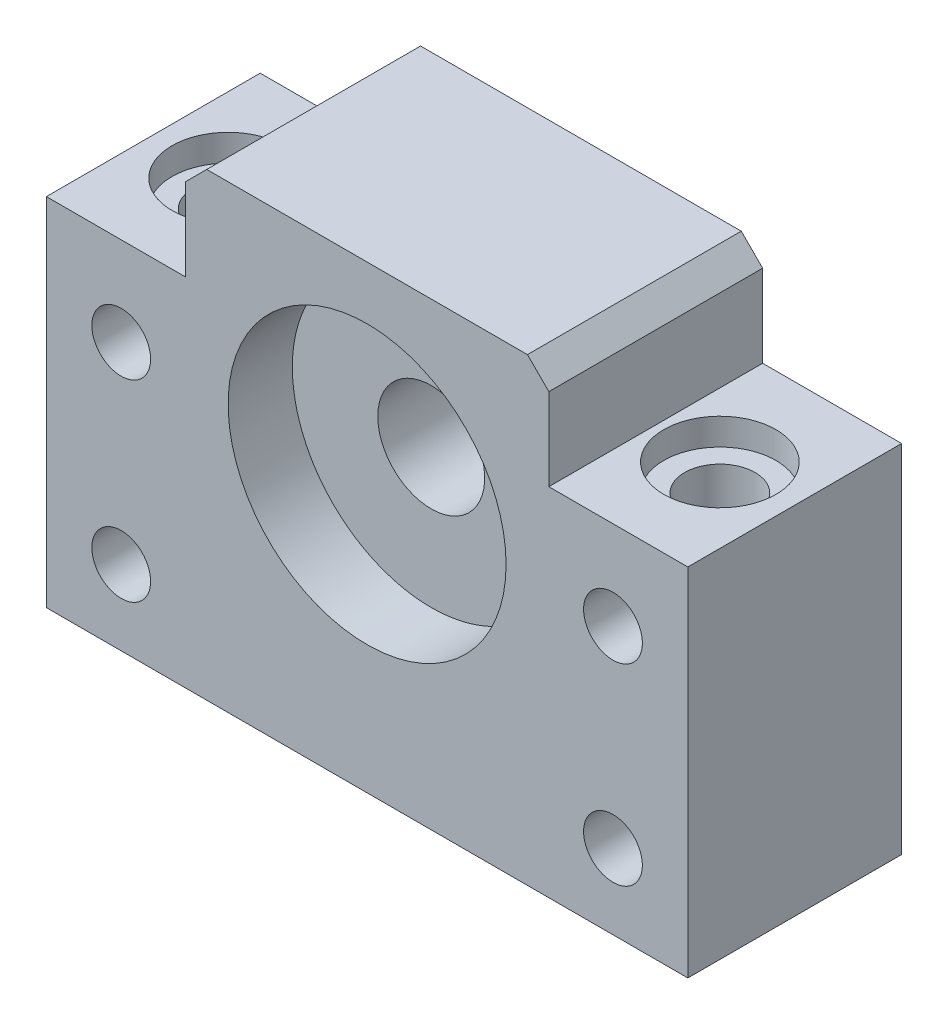
from build123d import *

# Parameters (mm, degrees)
SKIZZE1_R                       = 13
SKIZZE1_R_2                     = 2.75
AUFSATZ_LINEAR_AUSTRAGEN1_DEPTH = 10
AUFSATZ_LINEAR_START            = -6
SKIZZE2_R                       = 13
SKIZZE2_R_2                     = 5
AUFSATZ_LINEAR_AUSTRAGEN2_DEPTH = 8
SKIZZE3_R                       = 3.3
SCHNITT_LINEAR_AUSTRAGEN1_DEPTH = 60
SKIZZE4_R                       = 5.25
SCHNITT_LINEAR_AUSTRAGEN2_DEPTH = 2.5


with BuildPart() as part:
    # Skizze1 → Aufsatz-Linear austragen1 (new, symmetric)
    with BuildSketch(Plane.XY):
        Polygon((17, 41), (15, 43), (-15, 43), (-17, 41), (-17, 33.3), (-30, 33.3), (-30, 0), (30, 0), (30, 33.3), (17, 33.3), align=None)
        with Locations((0, 25)):
            Circle(SKIZZE1_R, mode=Mode.SUBTRACT)
        with Locations((23, 25)):
            Circle(SKIZZE1_R_2, mode=Mode.SUBTRACT)
        with Locations((23, 7)):
            Circle(SKIZZE1_R_2, mode=Mode.SUBTRACT)
        with Locations(Location((-23, 25, 0), (0, 0, 180))):
            Circle(SKIZZE1_R_2, mode=Mode.SUBTRACT)
        with Locations(Location((-23, 7, 0), (0, 0, 180))):
            Circle(SKIZZE1_R_2, mode=Mode.SUBTRACT)
    extrude(amount=AUFSATZ_LINEAR_AUSTRAGEN1_DEPTH, both=True)

    # Skizze3 → Schnitt-Linear austragen1 (cut)
    with BuildSketch(Plane(origin=(0, 33.3, 0), x_dir=(1, 0, 0), z_dir=(0, 1, 0))):
        with Locations(Location((23, 0, 0), (0, 0, 270))):
            Circle(SKIZZE3_R)
        with Locations(Location((-23, 0, 0), (0, 0, 270))):
            Circle(SKIZZE3_R)
    extrude(amount=-SCHNITT_LINEAR_AUSTRAGEN1_DEPTH, mode=Mode.SUBTRACT)

    # Skizze4 → Schnitt-Linear austragen2 (cut)
    with BuildSketch(Plane(origin=(0, 33.3, 0), x_dir=(1, 0, 0), z_dir=(0, 1, 0))):
        with Locations(Location((23, 0, 0), (0, 0, 270))):
            Circle(SKIZZE4_R)
        with Locations(Location((-23, 0, 0), (0, 0, 90))):
            Circle(SKIZZE4_R)
    extrude(amount=-SCHNITT_LINEAR_AUSTRAGEN2_DEPTH, mode=Mode.SUBTRACT)


with BuildPart() as body_2:
    # Skizze2 → Aufsatz-Linear austragen2 (new body)
    with BuildSketch(Plane(origin=(0, 0, -10), x_dir=(-1, 0, 0), z_dir=(0, 0, -1)).offset(AUFSATZ_LINEAR_START)):
        with Locations((0, 25)):
            Circle(SKIZZE2_R)
        with Locations((0, 25)):
            Circle(SKIZZE2_R_2, mode=Mode.SUBTRACT)
    extrude(amount=-AUFSATZ_LINEAR_AUSTRAGEN2_DEPTH)


solid = Compound([part.part, body_2.part])
